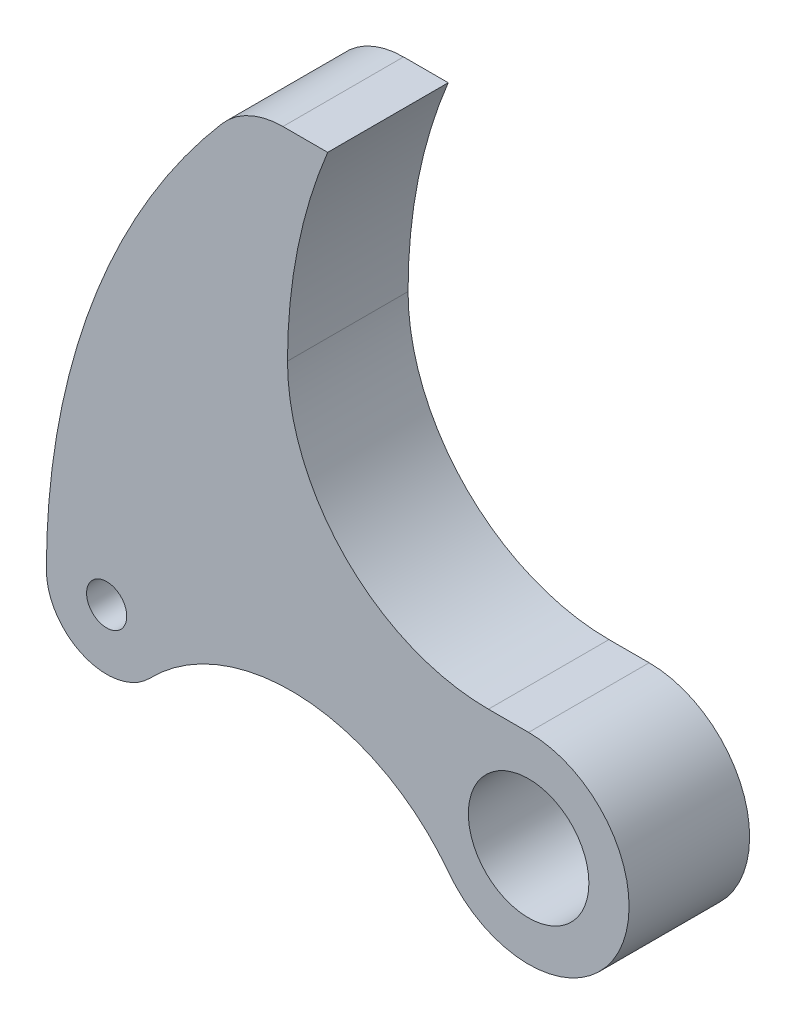
from build123d import *

# Parameters (mm, degrees)
CROQUIS2_R              = 1.5
CROQUIS2_R_2            = 0.5
SALIENTE_EXTRUIR1_DEPTH = 3


with BuildPart() as part:
    # Croquis2 → Saliente-Extruir1 (new body)
    with BuildSketch(Plane.XY):
        with BuildLine():
            Line((-1, 40), (0, 40))
            ThreePointArc((0, 40), (2.237600264, 36.385035848), (-1.995875264, 35.994516047))
            ThreePointArc((-1.995875264, 35.994516047), (-5.603547267, 37.933990418), (-9.423373519, 36.455550183))
            ThreePointArc((-9.423373519, 36.455550183), (-11.063498127, 36.109866963), (-12, 37.5))
            ThreePointArc((-12, 37.5), (-10.872626967, 43.792559296), (-7.630752828, 49.302325581))
            ThreePointArc((-7.630752828, 49.302325581), (-6.948145724, 49.817230195), (-6.112876654, 50))
            Line((-6.112876654, 50), (-5, 50))
            ThreePointArc((-5, 50), (-5.747548784, 47.549509757), (-6, 45))
            ThreePointArc((-6, 45), (-4.535533906, 41.464466094), (-1, 40))
        make_face()
        with Locations((0, 37.5)):
            Circle(CROQUIS2_R, mode=Mode.SUBTRACT)
        with Locations((-10.5, 37.5)):
            Circle(CROQUIS2_R_2, mode=Mode.SUBTRACT)
    extrude(amount=SALIENTE_EXTRUIR1_DEPTH)


solid = part.part
